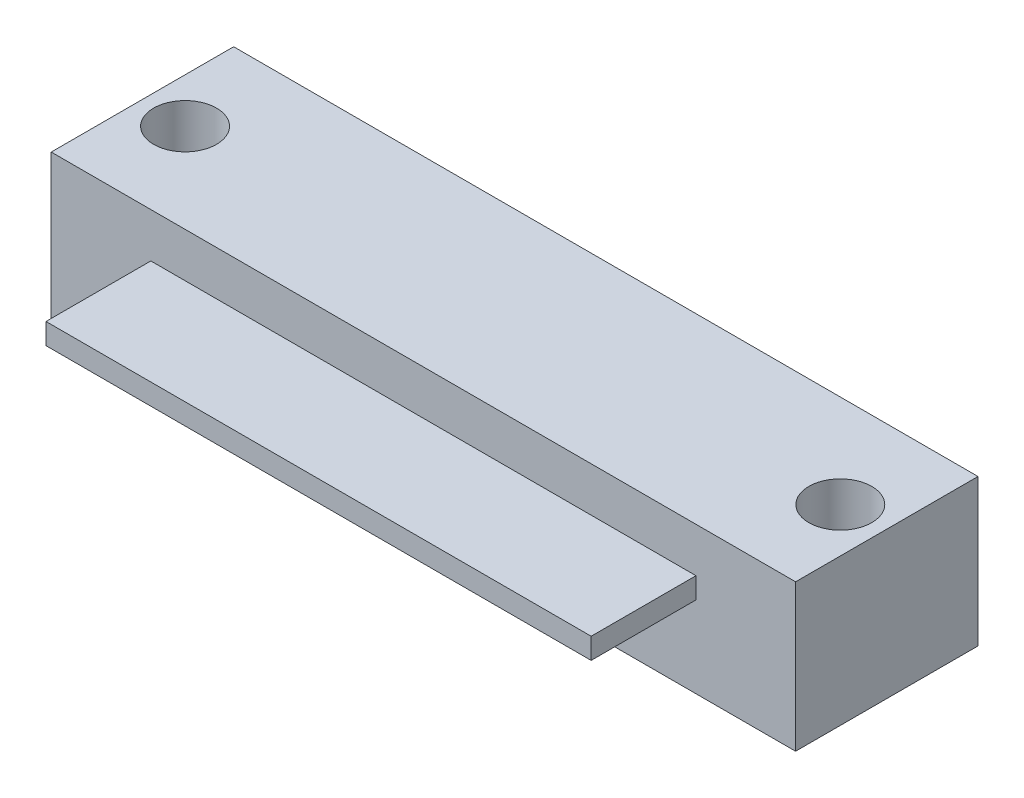
from build123d import *

# Parameters (mm, degrees)
SKETCH2_W                                           = 90.17
SKETCH2_H                                           = 22.098
BOSS_EXTRUDE1_DEPTH                                 = 17.78
SKETCH3_W                                           = 66.04
SKETCH3_H                                           = 2.54
BOSS_EXTRUDE2_DEPTH                                 = 12.7
CBORE_FOR_8_BINDING_HEAD_MACHINE_SCREW1_D           = 3.81
CBORE_FOR_8_BINDING_HEAD_MACHINE_SCREW1_CBORE_D     = 7.62
CBORE_FOR_8_BINDING_HEAD_MACHINE_SCREW1_CBORE_DEPTH = 11.176


with BuildPart() as part:
    # Sketch2 → Boss-Extrude1 (new body)
    with BuildSketch(Plane(origin=(0, 0, 0), x_dir=(1, 0, 0), z_dir=(0, 1, 0))):
        with Locations((45.085, 11.049)):
            Rectangle(SKETCH2_W, SKETCH2_H)
    extrude(amount=BOSS_EXTRUDE1_DEPTH)

    # Sketch3 → Boss-Extrude2 (add)
    with BuildSketch(Plane.XY):
        with Locations((45.085, 11.117631295)):
            Rectangle(SKETCH3_W, SKETCH3_H)
    extrude(amount=BOSS_EXTRUDE2_DEPTH)

    # CBORE for #8 Binding Head Machine Screw1 (through all)
    with Locations(Plane(origin=(0, 17.78, 0), x_dir=(1, 0, 0), z_dir=(0, 1, 0))):
        with Locations((5.3975, 10.814852879), (84.7725, 10.814852879)):
            CounterBoreHole(CBORE_FOR_8_BINDING_HEAD_MACHINE_SCREW1_D / 2, CBORE_FOR_8_BINDING_HEAD_MACHINE_SCREW1_CBORE_D / 2, CBORE_FOR_8_BINDING_HEAD_MACHINE_SCREW1_CBORE_DEPTH)


solid = part.part
